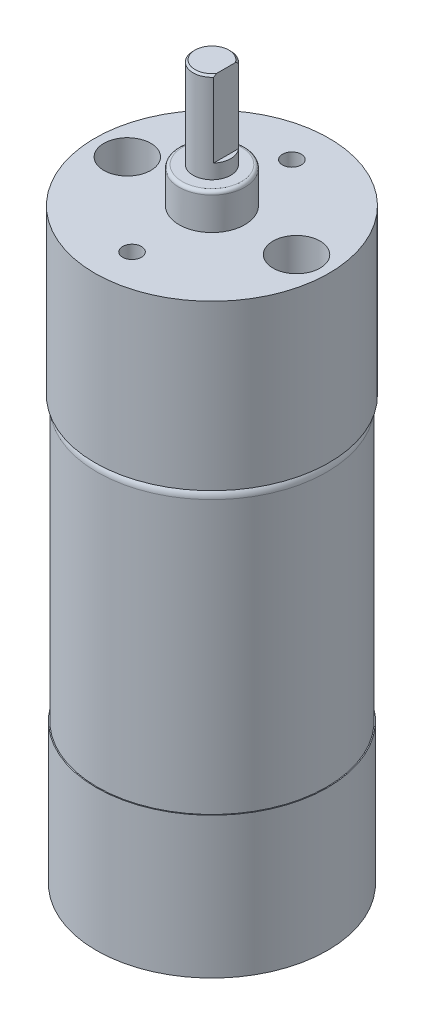
from build123d import *

# Parameters (mm, degrees)
CROQUIS1_R              = 12.3
SALIENTE_EXTRUIR1_DEPTH = 15
CROQUIS2_R              = 12.2
SALIENTE_EXTRUIR2_DEPTH = 30
REDONDEO1_R             = 1
CROQUIS3_R              = 12.45
SALIENTE_EXTRUIR3_DEPTH = 17.45
CROQUIS4_R              = 1
CROQUIS4_R_2            = 2.5
CORTAR_EXTRUIR1_DEPTH   = 8
CROQUIS5_R              = 3.5
SALIENTE_EXTRUIR4_DEPTH = 3.8
REDONDEO2_R             = 0.35
CROQUIS6_R              = 2
SALIENTE_EXTRUIR5_DEPTH = 9.64
CHAFL_N1_SIZE           = 0.2
CORTAR_EXTRUIR2_DEPTH   = 8.1


with BuildPart() as part:
    # Croquis1 → Saliente-Extruir1 (new body)
    with BuildSketch(Plane(origin=(0, 0, 0), x_dir=(1, 0, 0), z_dir=(0, 1, 0))):
        with Locations(Location((0, 0, 0), (0, 0, 270))):
            Circle(CROQUIS1_R)
    extrude(amount=SALIENTE_EXTRUIR1_DEPTH)


with BuildPart() as body_2:
    # Croquis2 → Saliente-Extruir2 (new body)
    with BuildSketch(Plane(origin=(0, 15, 0), x_dir=(1, 0, 0), z_dir=(0, 1, 0))):
        with Locations(Location((0, 0, 0), (0, 0, 270))):
            Circle(CROQUIS2_R)
    extrude(amount=SALIENTE_EXTRUIR2_DEPTH)

    # Redondeo1
    redondeo1_edges = [body_2.edges().sort_by_distance(p)[0] for p in [
        (0, 45, -12.2),
    ]]
    fillet(redondeo1_edges, radius=REDONDEO1_R)

    # Croquis3 → Saliente-Extruir3 (add)
    with BuildSketch(Plane(origin=(0, 45, 0), x_dir=(1, 0, 0), z_dir=(0, 1, 0))):
        with Locations(Location((0, 0, 0), (0, 0, 270))):
            Circle(CROQUIS3_R)
    extrude(amount=SALIENTE_EXTRUIR3_DEPTH)

    # Croquis4 → Cortar-Extruir1 (cut)
    with BuildSketch(Plane(origin=(0, 62.45, 0), x_dir=(1, 0, 0), z_dir=(0, 1, 0))):
        with Locations(Location((0, 8.5, 0), (0, 0, 270))):
            Circle(CROQUIS4_R)
        with Locations(Location((0, -8.5, 0), (0, 0, 90))):
            Circle(CROQUIS4_R)
        with Locations(Location((9, 0, 0), (0, 0, 270))):
            Circle(CROQUIS4_R_2)
        with Locations(Location((-9, 0, 0), (0, 0, 90))):
            Circle(CROQUIS4_R_2)
    extrude(amount=-CORTAR_EXTRUIR1_DEPTH, mode=Mode.SUBTRACT)

    # Croquis5 → Saliente-Extruir4 (add)
    with BuildSketch(Plane(origin=(0, 62.45, 0), x_dir=(1, 0, 0), z_dir=(0, 1, 0))):
        with Locations(Location((0, 0, 0), (0, 0, 90))):
            Circle(CROQUIS5_R)
    extrude(amount=SALIENTE_EXTRUIR4_DEPTH)

    # Redondeo2
    redondeo2_edges = [body_2.edges().sort_by_distance(p)[0] for p in [
        (0, 66.25, 3.5),
    ]]
    fillet(redondeo2_edges, radius=REDONDEO2_R)

    # Croquis6 → Saliente-Extruir5 (add)
    with BuildSketch(Plane(origin=(0, 66.25, 0), x_dir=(1, 0, 0), z_dir=(0, 1, 0))):
        with Locations(Location((0, 0, 0), (0, 0, 270))):
            Circle(CROQUIS6_R)
    extrude(amount=SALIENTE_EXTRUIR5_DEPTH)

    # Chaflán1
    chafl_n1_edges = [body_2.edges().sort_by_distance(p)[0] for p in [
        (0, 75.89, -2),
    ]]
    chamfer(chafl_n1_edges, length=CHAFL_N1_SIZE)

    # Croquis7 → Cortar-Extruir2 (cut)
    with BuildSketch(Plane(origin=(0, 75.89, 0), x_dir=(1, 0, 0), z_dir=(0, 1, 0))):
        with BuildLine():
            Line((1.5, 1.322875656), (1.5, -1.322875656))
            ThreePointArc((1.5, -1.322875656), (2, 0), (1.5, 1.322875656))
        make_face()
    extrude(amount=-CORTAR_EXTRUIR2_DEPTH, mode=Mode.SUBTRACT)


solid = Compound([part.part, body_2.part])
